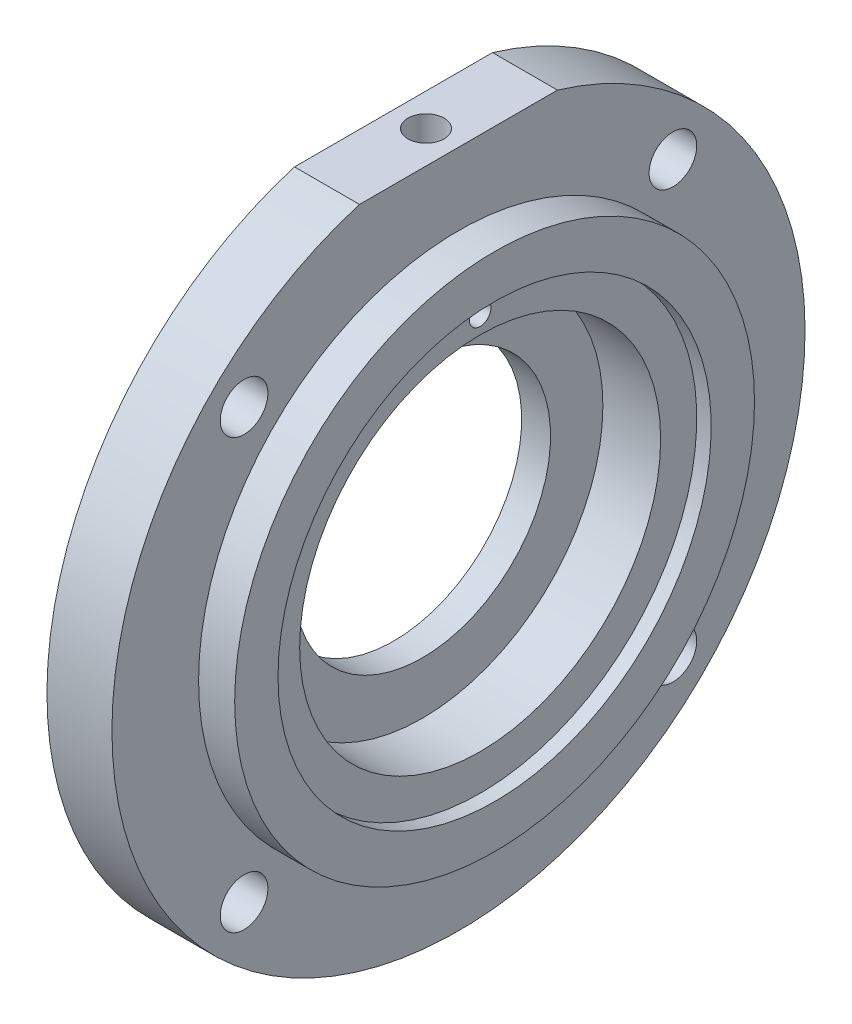
from build123d import *

# Parameters (mm, degrees)
SKETCH2_W                 = 27.422618402
SKETCH2_H                 = 2
CUT_EXTRUDE1_DEPTH        = 70.310893805
M6X1_0_TAPPED_HOLE1_D     = 5
M6X1_0_TAPPED_HOLE1_DEPTH = 7
M6X1_0_TAPPED_HOLE1_TIP   = 1.502151548
F_3_0MM_DOWEL_HOLE1_D     = 3
F_3_0MM_DOWEL_HOLE1_DEPTH = 11
F_3_0MM_DOWEL_HOLE1_TIP   = 0.901290929
F_3_0MM_DOWEL_HOLE3_D     = 3
F_3_0MM_DOWEL_HOLE3_DEPTH = 18.499
F_3_0MM_DOWEL_HOLE3_TIP   = 0.901290929
SKETCH16_R                = 3.3
CUT_EXTRUDE2_DEPTH        = 69.476273263
CIRPATTERN1_COUNT         = 4


with BuildPart() as part:
    # Sketch1 → Revolve1 (revolve)
    with BuildSketch(Plane.XY, mode=Mode.PRIVATE) as revolve1_sk:
        Polygon((0, 48), (0, 17.75), (4, 17.75), (4, 25), (12, 25), (12, 30), (14, 30), (14, 36), (9, 36), (9, 48), align=None)
    revolve(revolve1_sk.sketch.rotate(Axis((0, 0, 0), (1, 0, 0)), 90), axis=Axis((0, 0, 0), (1, 0, 0)))

    # Sketch2 → Cut-Extrude1 (cut, through all)
    with BuildSketch(Plane(origin=(0, 0, 0), x_dir=(0, 0, -1), z_dir=(1, 0, 0))):
        with Locations((0, 47)):
            Rectangle(SKETCH2_W, SKETCH2_H)
    extrude(amount=CUT_EXTRUDE1_DEPTH, mode=Mode.SUBTRACT)

    # M6x1.0 Tapped Hole1
    with Locations(Plane(origin=(0, 46, 0), x_dir=(1, 0, 0), z_dir=(0, 1, 0))):
        with Locations((4.5, 0)):
            Hole(M6X1_0_TAPPED_HOLE1_D / 2, depth=M6X1_0_TAPPED_HOLE1_DEPTH)
            with Locations((0, 0, -(M6X1_0_TAPPED_HOLE1_DEPTH + M6X1_0_TAPPED_HOLE1_TIP / 2))):  # 118° drill point
                Cone(0, M6X1_0_TAPPED_HOLE1_D / 2, M6X1_0_TAPPED_HOLE1_TIP, mode=Mode.SUBTRACT)

    # Ø3.0mm Dowel Hole1
    with Locations(Plane(origin=(14, 0, 0), x_dir=(0, 0, -1), z_dir=(1, 0, 0))):
        with Locations((0, 27.5)):
            Hole(F_3_0MM_DOWEL_HOLE1_D / 2, depth=F_3_0MM_DOWEL_HOLE1_DEPTH)
            with Locations((0, 0, -(F_3_0MM_DOWEL_HOLE1_DEPTH + F_3_0MM_DOWEL_HOLE1_TIP / 2))):  # 118° drill point
                Cone(0, F_3_0MM_DOWEL_HOLE1_D / 2, F_3_0MM_DOWEL_HOLE1_TIP, mode=Mode.SUBTRACT)

    # Ø3.0mm Dowel Hole3
    with Locations(Plane(origin=(0, 46, 0), x_dir=(1, 0, 0), z_dir=(0, 1, 0))):
        with Locations((4.5, 0)):
            Hole(F_3_0MM_DOWEL_HOLE3_D / 2, depth=F_3_0MM_DOWEL_HOLE3_DEPTH)
            with Locations((0, 0, -(F_3_0MM_DOWEL_HOLE3_DEPTH + F_3_0MM_DOWEL_HOLE3_TIP / 2))):  # 118° drill point
                Cone(0, F_3_0MM_DOWEL_HOLE3_D / 2, F_3_0MM_DOWEL_HOLE3_TIP, mode=Mode.SUBTRACT)

    # Sketch16 → Cut-Extrude2 (cut, through all)
    with BuildSketch(Plane(origin=(9, 0, 0), x_dir=(0, 0, -1), z_dir=(1, 0, 0))):
        with Locations((-29.69848481, 29.69848481)):
            Circle(SKETCH16_R)
    cut_extrude2 = extrude(amount=-CUT_EXTRUDE2_DEPTH, mode=Mode.SUBTRACT)

    # CirPattern1: Cut-Extrude2 ×4 about axis
    cirpattern1_axis = Axis((0, 0, 0), (1, 0, 0))
    for i in range(1, CIRPATTERN1_COUNT):
        add(cut_extrude2.rotate(cirpattern1_axis, i * 360 / CIRPATTERN1_COUNT), mode=Mode.SUBTRACT)


solid = part.part
